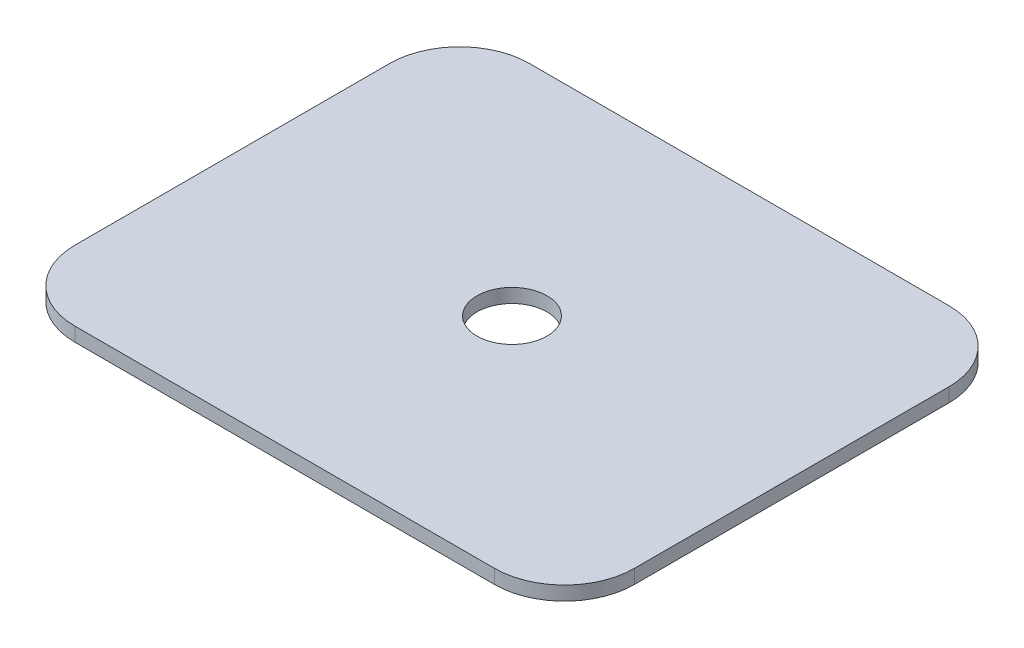
from build123d import *

# Parameters (mm, degrees)
SKETCH_10_R     = 5
EXTRUDE_1_DEPTH = 2


with BuildPart() as part:
    # Эскиз10 → Вытянуть1 (new body)
    with BuildSketch(Plane(origin=(0, 0, 0), x_dir=(1, 0, 0), z_dir=(0, 1, 0))):
        with BuildLine():
            Line((-30, 2), (30, 2))
            ThreePointArc((30, 2), (37.071067812, -0.928932188), (40, -8))
            Line((40, -8), (40, -53))
            ThreePointArc((40, -53), (37.071067812, -60.071067812), (30, -63))
            Line((30, -63), (-30, -63))
            ThreePointArc((-30, -63), (-37.071067812, -60.071067812), (-40, -53))
            Line((-40, -53), (-40, -8))
            ThreePointArc((-40, -8), (-37.071067812, -0.928932188), (-30, 2))
        make_face()
        with Locations(Location((0, -30.5, 0), (0, 0, 270))):
            Circle(SKETCH_10_R, mode=Mode.SUBTRACT)
    extrude(amount=EXTRUDE_1_DEPTH)


solid = part.part
